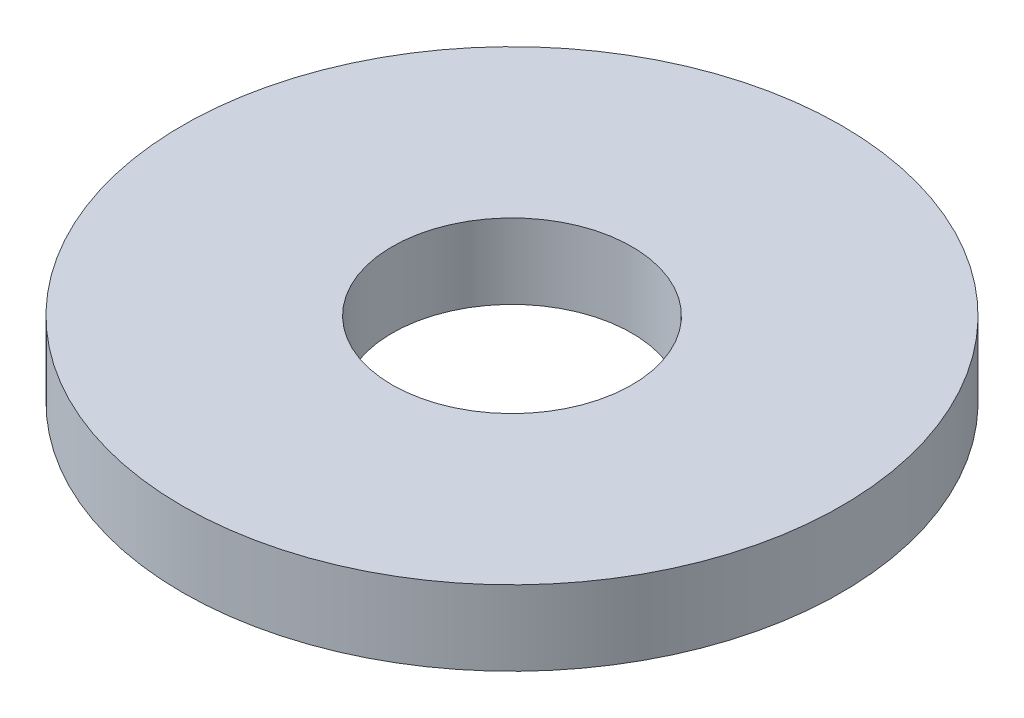
from build123d import *

# Parameters (mm, degrees)
SKETCH1_R           = 8.73125
SKETCH1_R_2         = 3.175
BOSS_EXTRUDE1_DEPTH = 1.984375


with BuildPart() as part:
    # Sketch1 → Boss-Extrude1 (new body)
    with BuildSketch(Plane(origin=(0, 0, 0), x_dir=(1, 0, 0), z_dir=(0, 1, 0))):
        with Locations(Location((0, 0, 0), (0, 0, 270))):
            Circle(SKETCH1_R)
        with Locations(Location((0, 0, 0), (0, 0, 270))):
            Circle(SKETCH1_R_2, mode=Mode.SUBTRACT)
    extrude(amount=BOSS_EXTRUDE1_DEPTH)


solid = part.part
